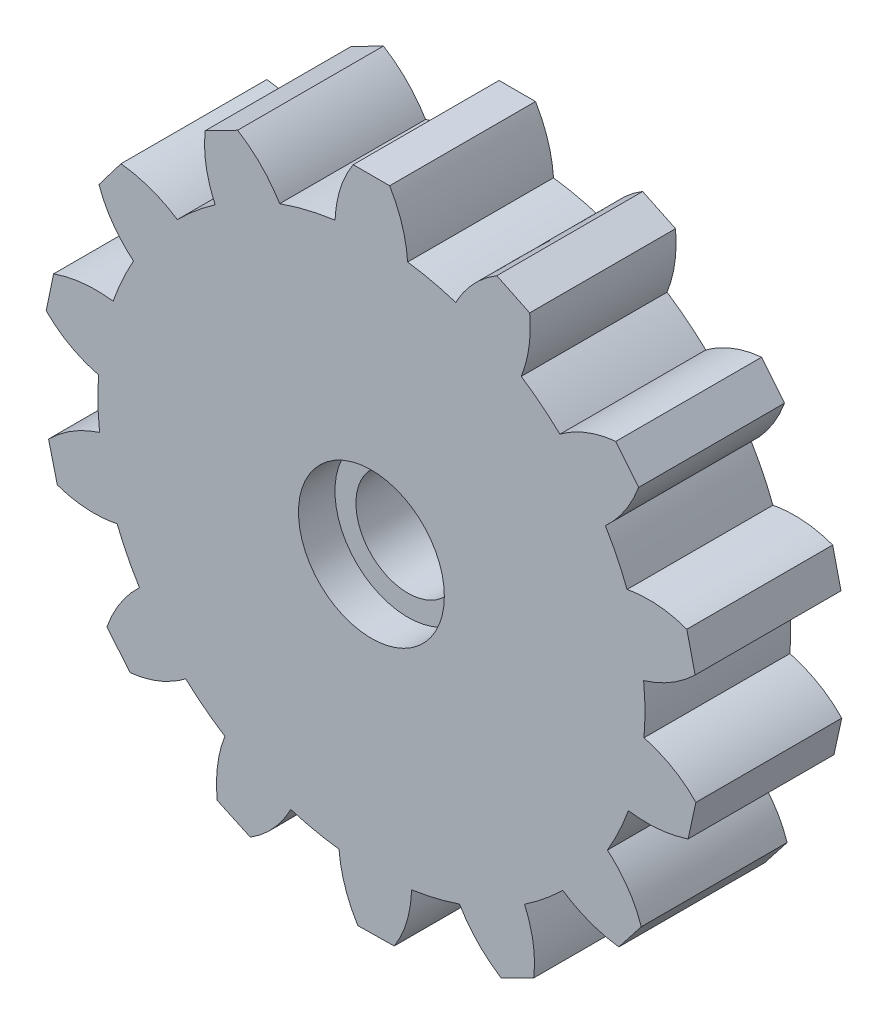
from build123d import *

# Parameters (mm, degrees)
BOSS_EXTRUDE1_DEPTH = 8
CIRPATTERN1_COUNT   = 14
CIRPATTERN1_ANGLE   = 332.8
SKETCH3_R           = 4
CUT_EXTRUDE2_DEPTH  = 2
SKETCH2_R           = 2.85
CUT_EXTRUDE4_DEPTH  = 14


with BuildPart() as part:
    # Sketch1 → Boss-Extrude1 (new body)
    with BuildSketch(Plane.XY):
        with BuildLine():
            Line((-1, 18), (1, 18))
            add(Edge.make_bspline(
                [(1, 18), (1.578443342, 17.032357733), (1.90693166, 15.988363393), (1.985464954, 14.86801698)],
                knots=[0, 0, 0, 0, 0.922231511, 0.922231511, 0.922231511, 0.922231511], degree=3))
            ThreePointArc((1.985464954, 14.86801698), (0.003612333, -14.999999565), (-1.99262582, 14.867058967))
            add(Edge.make_bspline(
                [(-1, 18), (-1.608825246, 17.079975603), (-1.93970052, 16.035661926), (-1.99262582, 14.867058967)],
                knots=[0, 0, 0, 0, 0.925626866, 0.925626866, 0.925626866, 0.925626866], degree=3))
        make_face()
    boss_extrude1 = extrude(amount=BOSS_EXTRUDE1_DEPTH)

    # CirPattern1: Boss-Extrude1 ×14 about axis
    cirpattern1_axis = Axis((0, 0, 8), (0, 0, -1))
    for i in range(1, CIRPATTERN1_COUNT):
        add(boss_extrude1.rotate(cirpattern1_axis, i * CIRPATTERN1_ANGLE / (CIRPATTERN1_COUNT - 1)))

    # Sketch3 → Cut-Extrude2 (cut)
    with BuildSketch(Plane.XY.offset(8)):
        Circle(SKETCH3_R)
    extrude(amount=-CUT_EXTRUDE2_DEPTH, mode=Mode.SUBTRACT)

    # Sketch2 → Cut-Extrude4 (cut)
    with BuildSketch(Plane.XY.offset(8)):
        Circle(SKETCH2_R)
    extrude(amount=-CUT_EXTRUDE4_DEPTH, mode=Mode.SUBTRACT)


solid = part.part
